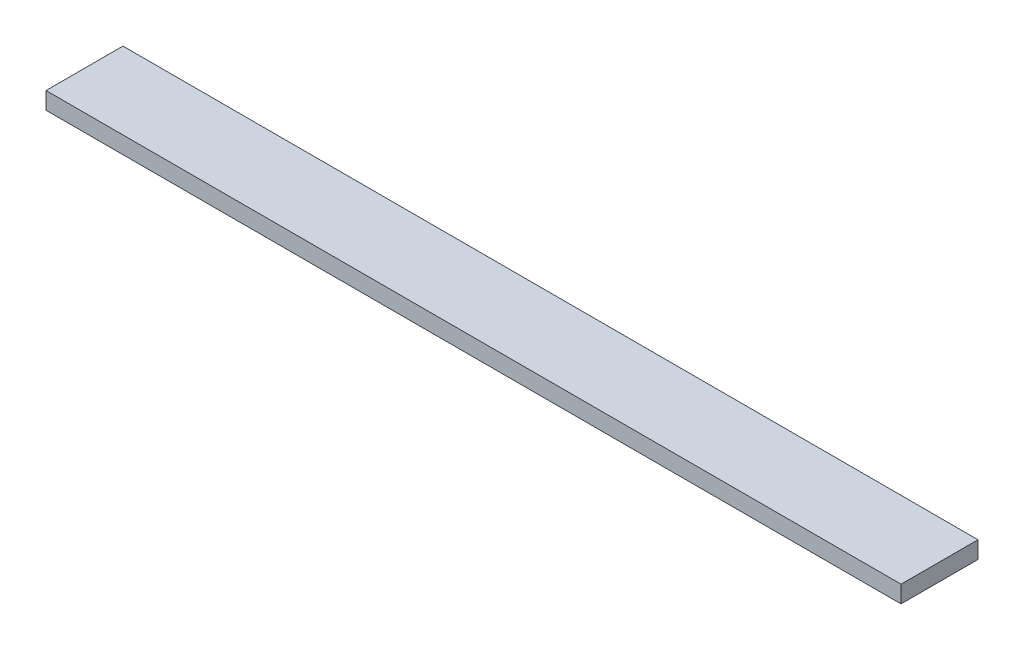
from build123d import *

# Parameters (mm, degrees)
SKETCH1_W           = 45
SKETCH1_H           = 10
BOSS_EXTRUDE1_DEPTH = 500


with BuildPart() as part:
    # Sketch1 → Boss-Extrude1 (new body)
    with BuildSketch(Plane(origin=(0, 0, 0), x_dir=(0, 0, -1), z_dir=(1, 0, 0))):
        with Locations((22.5, 5)):
            Rectangle(SKETCH1_W, SKETCH1_H)
    extrude(amount=BOSS_EXTRUDE1_DEPTH)


solid = part.part
